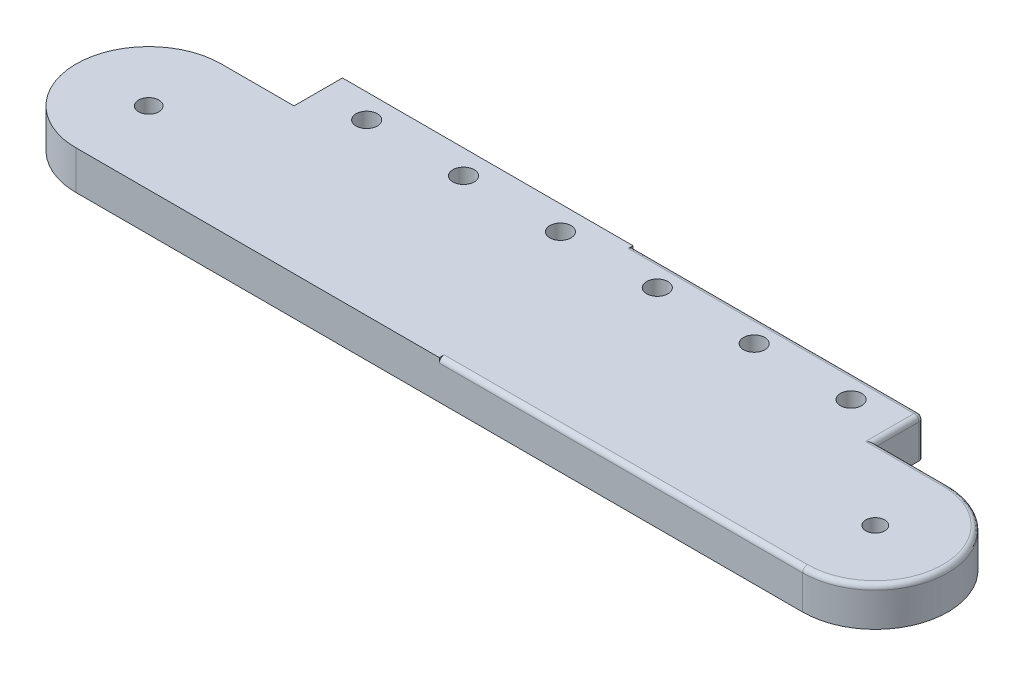
from build123d import *

# Parameters (mm, degrees)
BOSS_EXTRUDE1_DEPTH     = 4
SKETCH3_R               = 1.1
CUT_EXTRUDE2_DEPTH      = 50.406477448
CUT_EXTRUDE3_DEPTH      = 50.406477448
CUT_EXTRUDE3_DEPTH_BACK = 50.406477448
SKETCH4_R               = 0.99
SKETCH4_R_2             = 0.98
FILLET1_R               = 0.5
FILLET2_R               = 0.5
FILLET4_R               = 0.5
SKETCH5_W               = 16.044990583
SKETCH5_H               = 15
CUT_EXTRUDE4_DEPTH      = 10
SKETCH6_R               = 1.05
BOSS_EXTRUDE2_DEPTH     = 4
LPATTERN3_COUNT         = 5
LPATTERN3_PITCH         = 10
LPATTERN3_COUNT_DIR2    = 5
LPATTERN3_PITCH_DIR2    = 10


with BuildPart() as part:
    # Sketch2 → Boss-Extrude1 (new body)
    with BuildSketch(Plane(origin=(0, 0, 0), x_dir=(1, 0, 0), z_dir=(0, 1, 0))):
        with BuildLine():
            Line((-7.5, 0), (0, 0))
            Line((0, 0), (30, 0))
            Line((30, 0), (37.5, 0))
            add(Edge.make_bspline(
                [(37.5, 0), (45, 0), (45, 7.5), (45, 15), (37.5, 15)],
                knots=[0, 0, 0, 1.570796327, 1.570796327, 3.141592654, 3.141592654, 3.141592654], degree=2, weights=[1, 0.707106781, 1, 0.707106781, 1]))
            Line((37.5, 15), (30, 15))
            Line((30, 15), (30, 20))
            Line((30, 20), (0, 20))
            Line((0, 20), (0, 15))
            Line((0, 15), (-7.5, 15))
            add(Edge.make_bspline(
                [(-7.5, 15), (-15, 15), (-15, 7.5), (-15, 0), (-7.5, 0)],
                knots=[1.570796327, 1.570796327, 1.570796327, 3.141592654, 3.141592654, 4.71238898, 4.71238898, 4.71238898], degree=2, weights=[1, 0.707106781, 1, 0.707106781, 1]))
        make_face()
    extrude(amount=BOSS_EXTRUDE1_DEPTH)

    # Sketch3 → Cut-Extrude2 (cut, symmetric)
    with BuildSketch(Plane(origin=(0, 0, 0), x_dir=(1, 0, 0), z_dir=(0, 1, 0))):
        with Locations(Location((15, 17.5, 0), (0, 0, 270))):
            Circle(SKETCH3_R)
    cut_extrude2 = extrude(amount=CUT_EXTRUDE2_DEPTH, both=True, mode=Mode.SUBTRACT)

    # Sketch4 → Cut-Extrude3 (cut, two sides: drawn at the far end of the back side and taken through both)
    with BuildSketch(Plane(origin=(0, 0, 0), x_dir=(1, 0, 0), z_dir=(0, 1, 0)).offset(-CUT_EXTRUDE3_DEPTH_BACK)):
        with Locations(Location((-7.5, 7.5, 0), (0, 0, 270))):
            Circle(SKETCH4_R)
        with Locations(Location((37.5, 7.5, 0), (0, 0, 270))):
            Circle(SKETCH4_R_2)
    extrude(amount=CUT_EXTRUDE3_DEPTH + CUT_EXTRUDE3_DEPTH_BACK, mode=Mode.SUBTRACT)

    # Fillet1
    fillet1_edges = [part.edges().sort_by_distance(p)[0] for p in [
        (45, 4, -7.5),
        (33.75, 4, -15),
        (-3.75, 4, -15),
        (-15, 4, -7.5),
        (15, 4, 0),
    ]]
    fillet(fillet1_edges, radius=FILLET1_R)

    # Fillet2
    fillet2_edges = [part.edges().sort_by_distance(p)[0] for p in [
        (15, 4, -20),
    ]]
    fillet(fillet2_edges, radius=FILLET2_R)

    # Fillet4
    fillet4_edges = [part.edges().sort_by_distance(p)[0] for p in [
        (30, 1.75, -20),
        (30, 3.853553391, -19.853553391),
        (30, 4, -17),
    ]]
    fillet(fillet4_edges, radius=FILLET4_R)

    # Sketch5 → Cut-Extrude4 (cut)
    with BuildSketch(Plane(origin=(0, 0, 0), x_dir=(1, 0, 0), z_dir=(0, 1, 0))):
        with Locations((-8.022495292, 7.5)):
            Rectangle(SKETCH5_W, SKETCH5_H)
    extrude(amount=CUT_EXTRUDE4_DEPTH, mode=Mode.SUBTRACT)

    # Sketch6 → Boss-Extrude2 (add)
    with BuildSketch(Plane(origin=(0, 0, 0), x_dir=(1, 0, 0), z_dir=(0, 1, 0))):
        with BuildLine():
            Line((0, 0), (-37.5, 0))
            add(Edge.make_bspline(
                [(-37.5, 15), (-45, 15), (-45, 7.5), (-45, 0), (-37.5, 0)],
                knots=[3.141592654, 3.141592654, 3.141592654, 4.71238898, 4.71238898, 6.283185307, 6.283185307, 6.283185307], degree=2, weights=[1, 0.707106781, 1, 0.707106781, 1]))
            Line((-37.5, 15), (-30, 15))
            Line((-30, 15), (-30, 20))
            Line((-30, 20), (0, 20))
            Line((0, 20), (0, 0))
        make_face()
        with Locations(Location((-37.5, 7.5, 0), (0, 0, 270))):
            Circle(SKETCH6_R, mode=Mode.SUBTRACT)
    extrude(amount=BOSS_EXTRUDE2_DEPTH)

    # LPattern3: Cut-Extrude2 5 × 5
    with Locations(*[Vector(-1, 0, 0) * (i * LPATTERN3_PITCH) + Vector(1, 0, 0) * (j * LPATTERN3_PITCH_DIR2) for i in range(LPATTERN3_COUNT) for j in range(LPATTERN3_COUNT_DIR2) if (i, j) != (0, 0)]):
        add(cut_extrude2, mode=Mode.SUBTRACT)


solid = part.part
